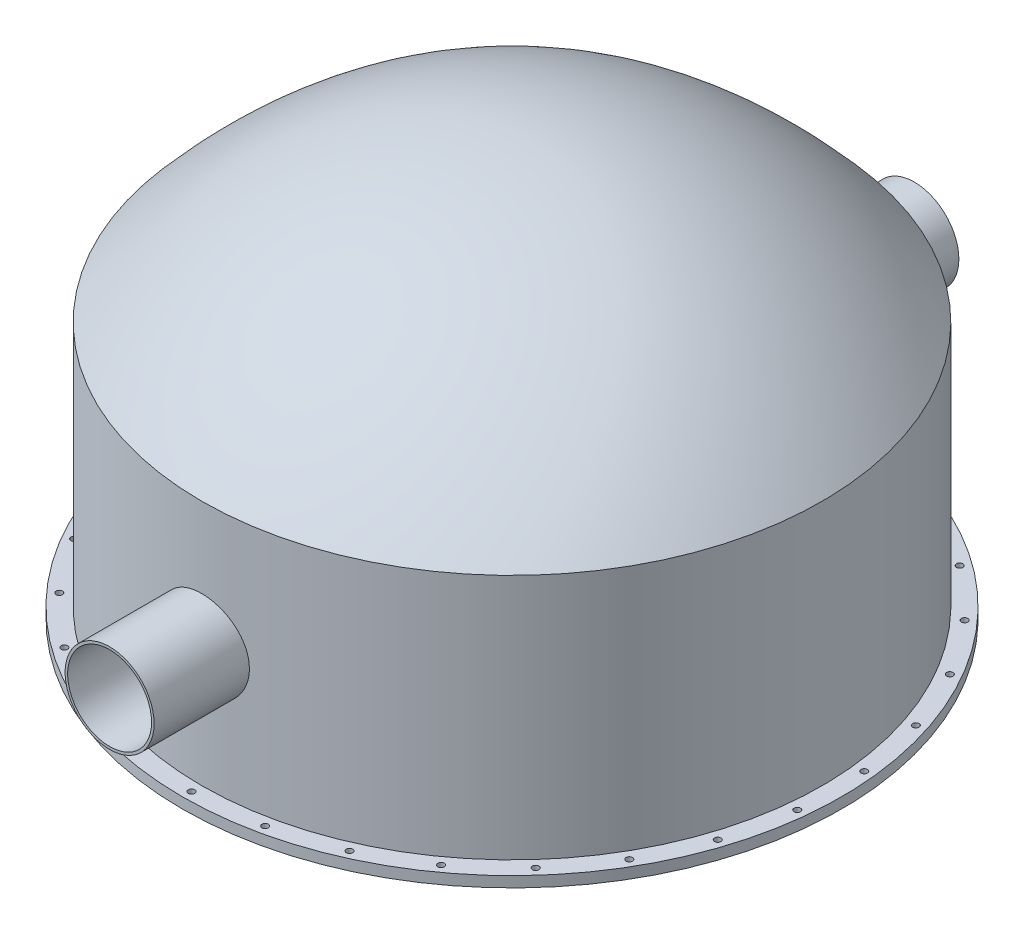
from build123d import *

# Parameters (mm, degrees)
BOSS_EXTRUDE1_REACH      = 5771.837
BOSS_EXTRUDE1_END_RADIUS = 2126.02
SKETCH2_R                = 304.8
SKETCH3_R                = 287.4
CUT_EXTRUDE1_DEPTH       = 6209.444849938
SKETCH4_R                = 22
CUT_EXTRUDE2_DEPTH       = 73


with BuildPart() as part:
    # Sketch1 → Revolve1 (revolve)
    with BuildSketch(Plane(origin=(0, 0, 0), x_dir=(0, 0, -1), z_dir=(1, 0, 0))):
        with BuildLine():
            Line((-2081.13, 0), (-2081.13, -1744.115))
            Line((-2081.13, -1744.115), (-2258.02, -1744.115))
            Line((-2258.02, -1744.115), (-2258.02, -1671.115))
            Line((-2258.02, -1671.115), (-2126.02, -1671.115))
            Line((-2126.02, -1671.115), (-2126.02, 16.908694058))
            add(Edge.make_bspline(
                [(0, 1089.3), (-12.392990415, 1089.3), (-37.206537081, 1089.124960777), (-86.605685239, 1088.074496713), (-148.081867942, 1085.447787548), (-221.365070258, 1080.19282346), (-294.169944863, 1072.834104858), (-366.489655143, 1063.371062264), (-462.265706687, 1047.947576946), (-580.757253644, 1023.40673665), (-720.95353597, 985.543401213), (-859.129239636, 939.274896904), (-995.260028391, 884.614710839), (-1129.325261675, 821.579795162), (-1261.308754394, 750.189410502), (-1391.199082661, 670.463922669), (-1518.989499495, 582.423674188), (-1644.67753802, 486.088031063), (-1747.666568989, 398.910261982), (-1829.009282888, 325.036960119), (-1889.492819428, 267.568143076), (-1949.453707229, 208.03705372), (-1998.986311153, 156.710506328), (-2038.352122681, 114.619388853), (-2062.847201264, 87.883738096), (-2082.378732273, 66.237350684), (-2094.557926136, 52.602456699), (-2104.287266127, 41.627271505), (-2110.35631283, 34.747743678), (-2115.219026543, 29.212570574), (-2120.008944205, 23.755456154), (-2123.617761564, 19.645057136), (-2126.02, 16.908694058)],
                knots=[0, 0, 0, 0, 0.015720051, 0.031440102, 0.062880204, 0.094320306, 0.125760408, 0.15720051, 0.188640612, 0.251520816, 0.31440102, 0.377281224, 0.440161428, 0.503041632, 0.565921836, 0.62880204, 0.691682244, 0.754562448, 0.817442652, 0.848882754, 0.880322856, 0.911762958, 0.94320306, 0.958923111, 0.974643162, 0.982503188, 0.990363213, 0.994293226, 0.998223239, 1.000188245, 1.002153251, 1.006083264, 1.006083264, 1.006083264, 1.006083264], degree=3))
            Line((0, 1089.3), (0, 1044.41))
            add(Edge.make_bspline(
                [(0, 1044.41), (-1164.248075476, 1044.41), (-2081.13, 0)],
                knots=[0, 0, 0, 1, 1, 1], degree=2))
        make_face()
    revolve(axis=Axis((0, 1089.3, 0), (0, -1, 0)))

    # Boss-Extrude1: up to this cylinder (the profile starts outside it)
    boss_extrude1_end = Plane(origin=(0, -835.615, 0), z_dir=(0, 1, 0)) * Cylinder(BOSS_EXTRUDE1_END_RADIUS, 15796.714, mode=Mode.PRIVATE)
    # Sketch2 → Boss-Extrude1 (add, up to the surface)
    with BuildSketch(Plane.XY.offset(2757), mode=Mode.PRIVATE) as boss_extrude1_sk1:
        with Locations((0, -835.615)):
            Circle(SKETCH2_R)
    boss_extrude1_tool1 = extrude(boss_extrude1_sk1.sketch, amount=-BOSS_EXTRUDE1_REACH, mode=Mode.PRIVATE) - boss_extrude1_end
    boss_extrude1 = boss_extrude1_tool1.solids().sort_by_distance((0, -835.615, 2757))[0]
    add(boss_extrude1)

    # Mirror1: Boss-Extrude1 across plane
    add(boss_extrude1.mirror(Plane.XY))

    # Sketch3 → Cut-Extrude1 (cut, through all)
    with BuildSketch(Plane.XY.offset(2757)):
        with Locations((0, -835.615)):
            Circle(SKETCH3_R)
    extrude(amount=-CUT_EXTRUDE1_DEPTH, mode=Mode.SUBTRACT)

    # Sketch4 → Cut-Extrude2 (cut)
    with BuildSketch(Plane.XZ.offset(1744.115)):
        with Locations(Location((0, 2196.0235, 0), (0, 0, 270))):
            Circle(SKETCH4_R)
        with Locations(Location((456.578958961, 2148.03511768, 0), (0, 0, 270))):
            Circle(SKETCH4_R)
        with Locations(Location((893.203226506, 2006.167293301, 0), (0, 0, 270))):
            Circle(SKETCH4_R)
        with Locations(Location((1290.790226988, 1776.620331547, 0), (0, 0, 270))):
            Circle(SKETCH4_R)
        with Locations(Location((1631.963500652, 1469.426536133, 0), (0, 0, 270))):
            Circle(SKETCH4_R)
        with Locations(Location((1901.812138308, 1098.01175, 0), (0, 0, 270))):
            Circle(SKETCH4_R)
        with Locations(Location((2088.542459612, 678.608581547, 0), (0, 0, 270))):
            Circle(SKETCH4_R)
        with Locations(Location((2183.993453493, 229.546961755, 0), (0, 0, 270))):
            Circle(SKETCH4_R)
        with Locations(Location((2183.993453493, -229.546961755, 0), (0, 0, 270))):
            Circle(SKETCH4_R)
        with Locations(Location((2088.542459612, -678.608581547, 0), (0, 0, 270))):
            Circle(SKETCH4_R)
        with Locations(Location((1901.812138308, -1098.01175, 0), (0, 0, 270))):
            Circle(SKETCH4_R)
        with Locations(Location((1631.963500652, -1469.426536133, 0), (0, 0, 270))):
            Circle(SKETCH4_R)
        with Locations(Location((1290.790226988, -1776.620331547, 0), (0, 0, 270))):
            Circle(SKETCH4_R)
        with Locations(Location((893.203226506, -2006.167293301, 0), (0, 0, 270))):
            Circle(SKETCH4_R)
        with Locations(Location((456.578958961, -2148.03511768, 0), (0, 0, 270))):
            Circle(SKETCH4_R)
        with Locations(Location((0, -2196.0235, 0), (0, 0, 270))):
            Circle(SKETCH4_R)
        with Locations(Location((-456.57895896, -2148.03511768, 0), (0, 0, 270))):
            Circle(SKETCH4_R)
        with Locations(Location((-893.203226505, -2006.167293301, 0), (0, 0, 270))):
            Circle(SKETCH4_R)
        with Locations(Location((-1290.790226988, -1776.620331547, 0), (0, 0, 270))):
            Circle(SKETCH4_R)
        with Locations(Location((-1631.963500652, -1469.426536133, 0), (0, 0, 270))):
            Circle(SKETCH4_R)
        with Locations(Location((-1901.812138307, -1098.01175, 0), (0, 0, 270))):
            Circle(SKETCH4_R)
        with Locations(Location((-2088.542459612, -678.608581547, 0), (0, 0, 270))):
            Circle(SKETCH4_R)
        with Locations(Location((-2183.993453493, -229.546961755, 0), (0, 0, 270))):
            Circle(SKETCH4_R)
        with Locations(Location((-2183.993453493, 229.546961755, 0), (0, 0, 270))):
            Circle(SKETCH4_R)
        with Locations(Location((-2088.542459612, 678.608581547, 0), (0, 0, 270))):
            Circle(SKETCH4_R)
        with Locations(Location((-1901.812138308, 1098.01175, 0), (0, 0, 270))):
            Circle(SKETCH4_R)
        with Locations(Location((-1631.963500652, 1469.426536133, 0), (0, 0, 270))):
            Circle(SKETCH4_R)
        with Locations(Location((-1290.790226988, 1776.620331547, 0), (0, 0, 270))):
            Circle(SKETCH4_R)
        with Locations(Location((-893.203226506, 2006.167293301, 0), (0, 0, 270))):
            Circle(SKETCH4_R)
        with Locations(Location((-456.578958961, 2148.03511768, 0), (0, 0, 270))):
            Circle(SKETCH4_R)
    extrude(amount=-CUT_EXTRUDE2_DEPTH, mode=Mode.SUBTRACT)


solid = part.part
